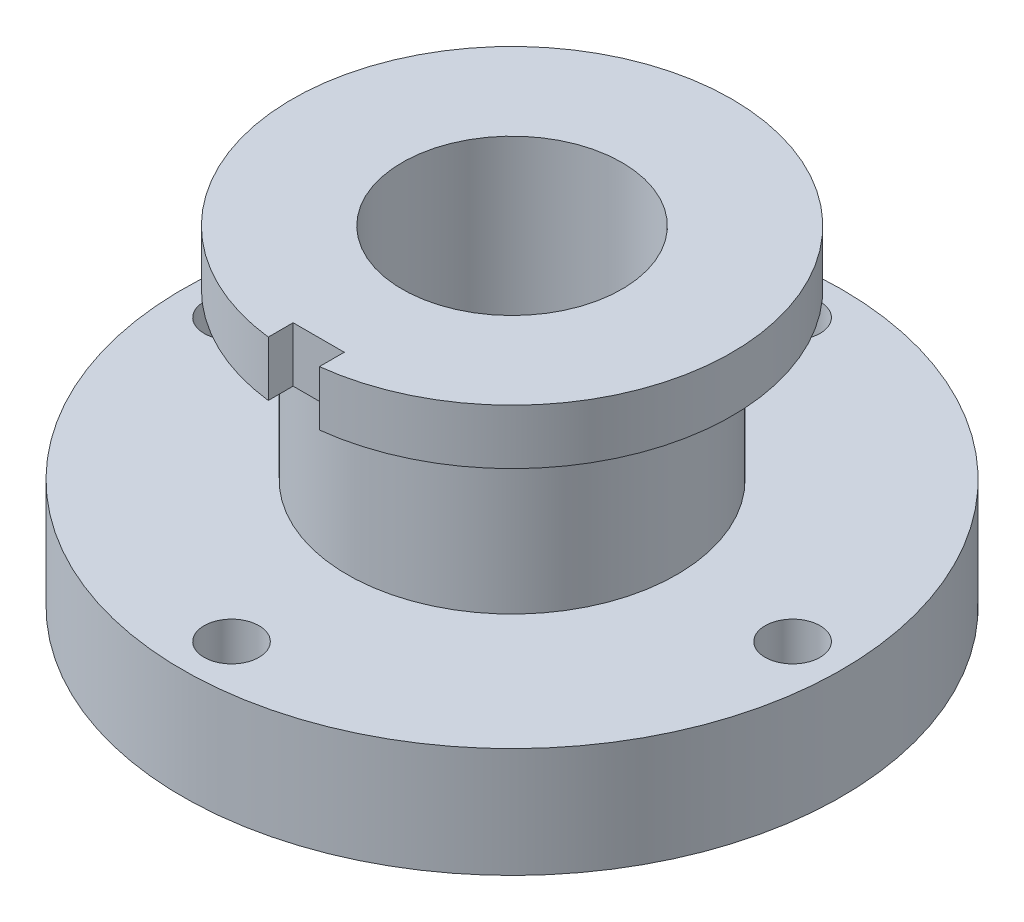
from build123d import *

# Parameters (mm, degrees)
SKETCH5_R          = 25
CUT_EXTRUDE2_DEPTH = 100
SKETCH6_W          = 46.553094274
SKETCH6_H          = 47.963737356
CUT_EXTRUDE3_DEPTH = 60


with BuildPart() as part:
    # Sketch4 → Revolve2 (revolve)
    with BuildSketch(Plane.XY):
        Polygon((0, -251.612903226), (0, -151.612903226), (100, -151.612903226), (100, 48.387096774), (152.822580645, 48.387096774), (200, 48.387096774), (200, -1.612903226), (150, -1.612903226), (150, -151.612903226), (300, -151.612903226), (300, -251.612903226), align=None)
    revolve(axis=Axis((0, -251.612903226, 0), (0, 1, 0)))

    # Sketch5 → Cut-Extrude2 (cut)
    with BuildSketch(Plane(origin=(0, -151.612903226, 0), x_dir=(1, 0, 0), z_dir=(0, 1, 0))):
        with Locations((0, 255.365455535)):
            Circle(SKETCH5_R)
        with Locations((255.365455535, 0)):
            Circle(SKETCH5_R)
        with Locations((0, -255.365455535)):
            Circle(SKETCH5_R)
        with Locations((-255.365455535, 0)):
            Circle(SKETCH5_R)
    extrude(amount=-CUT_EXTRUDE2_DEPTH, mode=Mode.SUBTRACT)

    # Sketch6 → Cut-Extrude3 (cut)
    with BuildSketch(Plane(origin=(0, 48.387096774, 0), x_dir=(1, 0, 0), z_dir=(0, 1, 0))):
        with Locations((0, -200)):
            Rectangle(SKETCH6_W, SKETCH6_H)
    extrude(amount=-CUT_EXTRUDE3_DEPTH, mode=Mode.SUBTRACT)


solid = part.part
